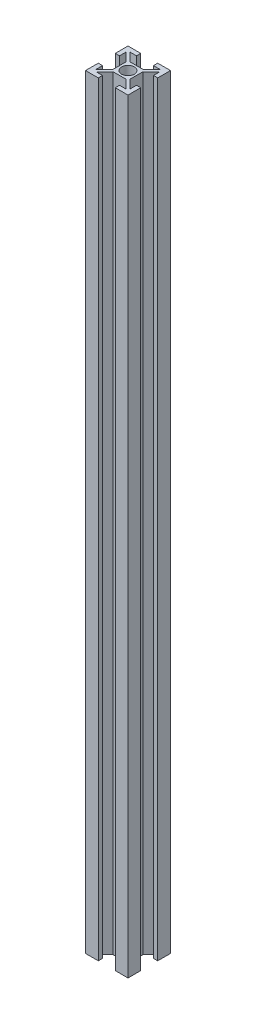
from build123d import *

# Parameters (mm, degrees)
F_2020_SKETCH_R     = 3
BOSS_EXTRUDE1_DEPTH = 360


with BuildPart() as part:
    # 2020 sketch → Boss-Extrude1 (new body)
    with BuildSketch(Plane(origin=(0, 0, 0), x_dir=(1, 0, 0), z_dir=(0, 1, 0))):
        Polygon((-4, 10), (-4, 8), (-7, 8), (-3, 4), (3, 4), (7, 8), (4, 8), (4, 10), (10, 10), (10, 4), (8, 4), (8, 7), (4, 3), (4, -3), (8, -7), (8, -4), (10, -4), (10, -10), (4, -10), (4, -8), (7, -8), (3, -4), (-3, -4), (-7, -8), (-4, -8), (-4, -10), (-10, -10), (-10, -4), (-8, -4), (-8, -7), (-4, -3), (-4, 3), (-8, 7), (-8, 4), (-10, 4), (-10, 10), align=None)
        with Locations(Location((0, 0, 0), (0, 0, 90))):
            Circle(F_2020_SKETCH_R, mode=Mode.SUBTRACT)
    extrude(amount=BOSS_EXTRUDE1_DEPTH)


solid = part.part
